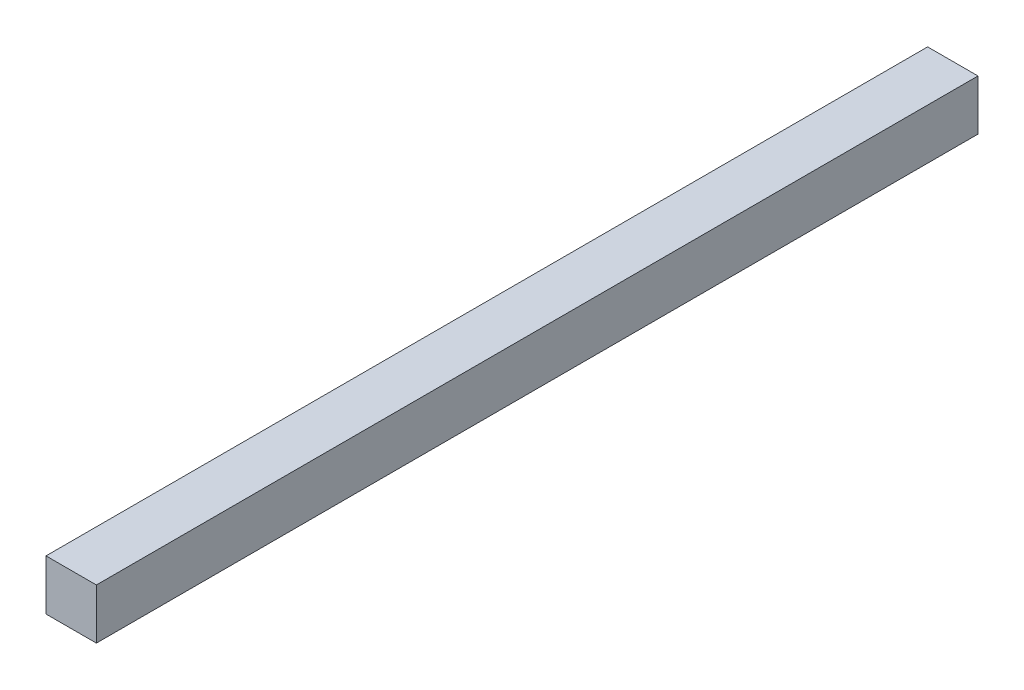
from build123d import *

# Parameters (mm, degrees)
SKETCH_1_W      = 20
SKETCH_1_H      = 20
EXTRUDE_1_DEPTH = 350


with BuildPart() as part:
    # 草圖1 → 填料-伸長1 (new body)
    with BuildSketch(Plane.XY):
        Rectangle(SKETCH_1_W, SKETCH_1_H)
    extrude(amount=EXTRUDE_1_DEPTH)


solid = part.part
